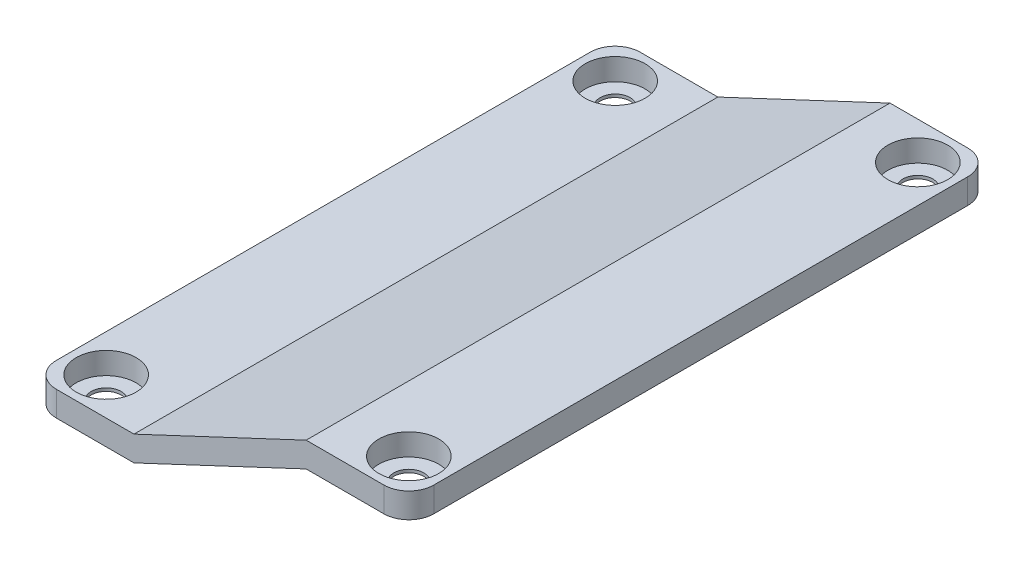
from build123d import *

# Parameters (mm, degrees)
COVER_BODY_DEPTH                        = 117
CBORE_FOR_M6_HEX_HEAD_BOLT1_D           = 6
CBORE_FOR_M6_HEX_HEAD_BOLT1_CBORE_D     = 12
CBORE_FOR_M6_HEX_HEAD_BOLT1_CBORE_DEPTH = 4.38
CBORE_FOR_M6_HEX_HEAD_BOLT2_D           = 6
CBORE_FOR_M6_HEX_HEAD_BOLT2_CBORE_D     = 12
CBORE_FOR_M6_HEX_HEAD_BOLT2_CBORE_DEPTH = 4.38
FILLET1_R                               = 5


with BuildPart() as part:
    # Sketch1 → Cover Body (new body)
    with BuildSketch(Plane.XY):
        Polygon((-17.507754177, -4.568983292), (16.992245823, 11.631016708), (37.567245823, 11.631016708), (37.567245823, 6.631016708), (16.992245823, 6.631016708), (-17.507754177, -9.568983292), (-38.082754177, -9.568983292), (-38.082754177, -4.568983292), align=None)
    extrude(amount=-COVER_BODY_DEPTH)

    # CBORE for M6 Hex Head Bolt1 (through all)
    with Locations(Plane(origin=(0, -4.568983292, 0), x_dir=(1, 0, 0), z_dir=(0, 1, 0))):
        with Locations((-30.582754177, 109.5), (-30.582754177, 7.5)):
            CounterBoreHole(CBORE_FOR_M6_HEX_HEAD_BOLT1_D / 2, CBORE_FOR_M6_HEX_HEAD_BOLT1_CBORE_D / 2, CBORE_FOR_M6_HEX_HEAD_BOLT1_CBORE_DEPTH)

    # CBORE for M6 Hex Head Bolt2 (through all)
    with Locations(Plane(origin=(0, 11.631016708, 0), x_dir=(1, 0, 0), z_dir=(0, 1, 0))):
        with Locations((30.067245823, 7.5), (30.067245823, 109.5)):
            CounterBoreHole(CBORE_FOR_M6_HEX_HEAD_BOLT2_D / 2, CBORE_FOR_M6_HEX_HEAD_BOLT2_CBORE_D / 2, CBORE_FOR_M6_HEX_HEAD_BOLT2_CBORE_DEPTH)

    # Fillet1
    fillet1_edges = [part.edges().sort_by_distance(p)[0] for p in [
        (37.567245823, 9.131016708, 0),
        (37.567245823, 9.131016708, -117),
        (-38.082754177, -7.068983292, -117),
        (-38.082754177, -7.068983292, 0),
    ]]
    fillet(fillet1_edges, radius=FILLET1_R)


solid = part.part
